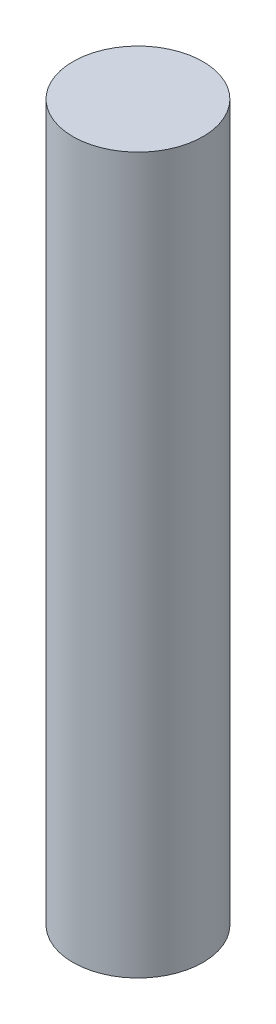
from build123d import *

# Parameters (mm, degrees)
BOSS_EXTRUDE1_DEPTH      = 9
BOSS_EXTRUDE1_DEPTH_BACK = 13
SKETCH1_R                = 2


with BuildPart() as part:
    # Sketch1 → Boss-Extrude1 (new, two sides: drawn at the far end of the back side and taken through both)
    with BuildSketch(Plane(origin=(0, 0, 0), x_dir=(1, 0, 0), z_dir=(0, 1, 0)).offset(-BOSS_EXTRUDE1_DEPTH_BACK)):
        with Locations(Location((0, 0, 0), (0, 0, 270))):
            Circle(SKETCH1_R)
    extrude(amount=BOSS_EXTRUDE1_DEPTH + BOSS_EXTRUDE1_DEPTH_BACK)


solid = part.part
